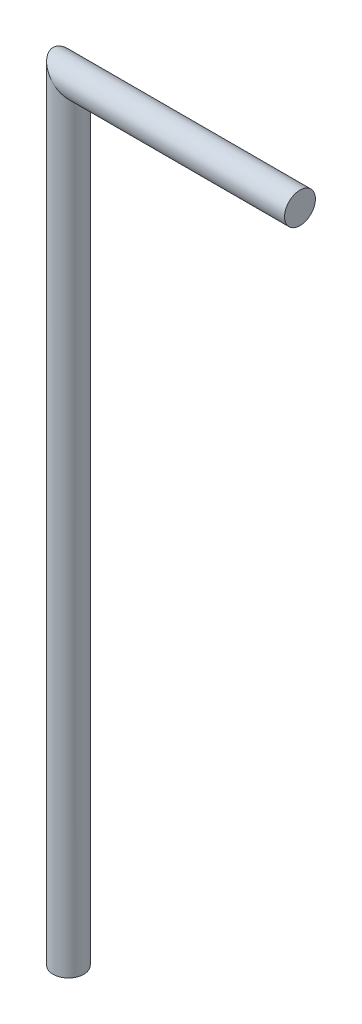
from build123d import *

# Parameters (mm, degrees)
SKETCH3_R = 1


with BuildPart() as part:
    # Sweep1: sweep along a path in Sketch2
    with BuildLine(Plane.XY) as sweep1_path:
        Line((0, 0), (0, 50))
        Line((0, 50), (15, 50))
    # Sketch3 → Sweep1 (sweep)
    with BuildSketch(Plane(origin=(0, 0, 0), x_dir=(1, 0, 0), z_dir=(0, 1, 0))):
        Circle(SKETCH3_R)
    sweep(path=sweep1_path.line, transition=Transition.RIGHT)


solid = part.part
